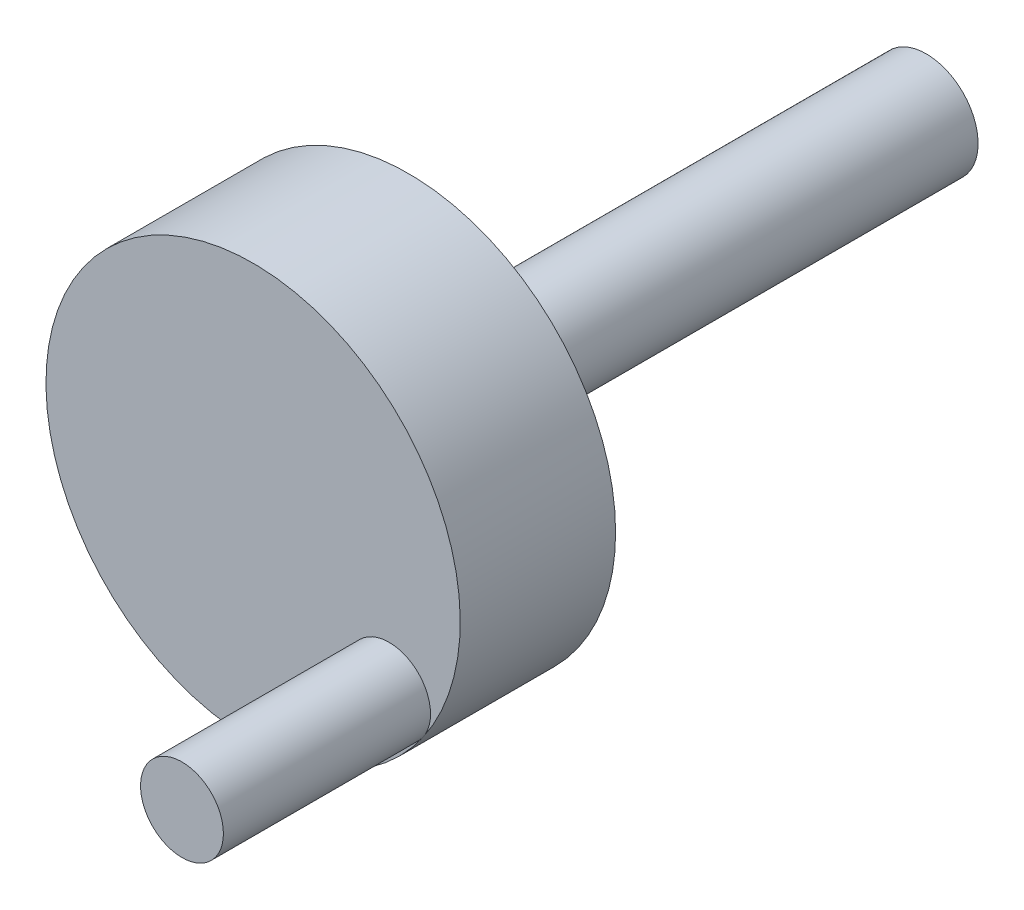
from build123d import *

# Parameters (mm, degrees)
SKETCH1_R           = 20
BOSS_EXTRUDE1_DEPTH = 15
SKETCH2_R           = 4
BOSS_EXTRUDE2_DEPTH = 20
SKETCH3_R           = 5
BOSS_EXTRUDE3_DEPTH = 50


with BuildPart() as part:
    # Sketch1 → Boss-Extrude1 (new body)
    with BuildSketch(Plane.XY):
        Circle(SKETCH1_R)
    extrude(amount=BOSS_EXTRUDE1_DEPTH)

    # Sketch2 → Boss-Extrude2 (add)
    with BuildSketch(Plane.XY.offset(15)):
        with Locations(Location((13.13246531, -9.139931886, 0), (0, 0, 325.162859044))):
            Circle(SKETCH2_R)
    extrude(amount=BOSS_EXTRUDE2_DEPTH)

    # Sketch3 → Boss-Extrude3 (add)
    with BuildSketch(Plane(origin=(0, 0, 0), x_dir=(-1, 0, 0), z_dir=(0, 0, -1))):
        Circle(SKETCH3_R)
    extrude(amount=BOSS_EXTRUDE3_DEPTH)


solid = part.part
